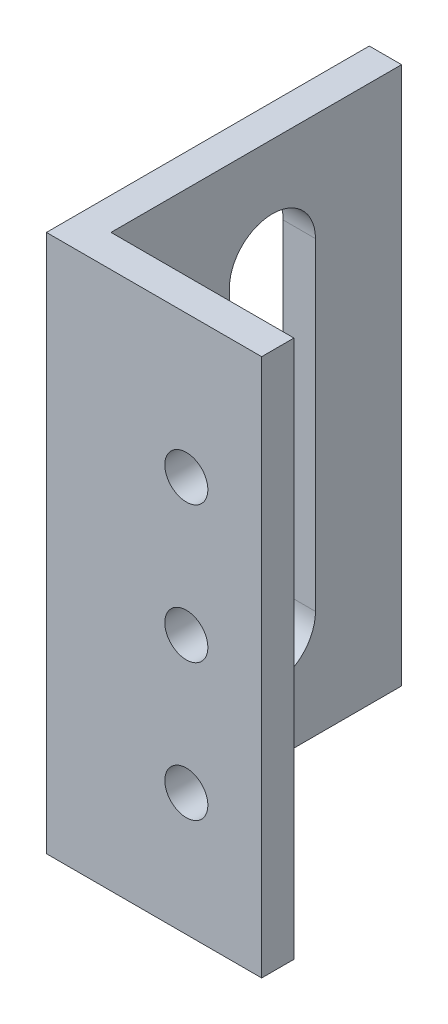
from build123d import *

# Parameters (mm, degrees)
SKETCH_1_W          = 3
SKETCH_1_H          = 27
SKETCH_1_H_2        = 3
SKETCH_1_W_2        = 17
EXTRUDE_1_DEPTH     = 50
SKETCH_2_R          = 2
CUT_EXTRUDE_1_DEPTH = 10
CUT_EXTRUDE_2_DEPTH = 10


with BuildPart() as part:
    # 草图1 → 凸台-拉伸1 (new body)
    with BuildSketch(Plane(origin=(0, 0, 0), x_dir=(1, 0, 0), z_dir=(0, 1, 0))):
        with Locations((0, 1.5)):
            Rectangle(SKETCH_1_W, SKETCH_1_H)
        with Locations((0, -13.5)):
            Rectangle(SKETCH_1_W, SKETCH_1_H_2)
        with Locations((10, -13.5)):
            Rectangle(SKETCH_1_W_2, SKETCH_1_H_2)
    extrude(amount=EXTRUDE_1_DEPTH)

    # 草图2 → 切除-拉伸1 (cut)
    with BuildSketch(Plane.XY.offset(15)):
        with Locations((11.5, 36.8)):
            Circle(SKETCH_2_R)
        with Locations((11.5, 24.1)):
            Circle(SKETCH_2_R)
        with Locations((11.5, 11.4)):
            Circle(SKETCH_2_R)
    extrude(amount=-CUT_EXTRUDE_1_DEPTH, mode=Mode.SUBTRACT)

    # 草图3 → 切除-拉伸2 (cut)
    with BuildSketch(Plane.ZY.offset(1.5)):
        with BuildLine():
            Line((1, 40), (1, 10))
            ThreePointArc((1, 10), (-3, 6), (-7, 10))
            Line((-7, 10), (-7, 40))
            ThreePointArc((-7, 40), (-3, 44), (1, 40))
        make_face()
    extrude(amount=-CUT_EXTRUDE_2_DEPTH, mode=Mode.SUBTRACT)


solid = part.part
